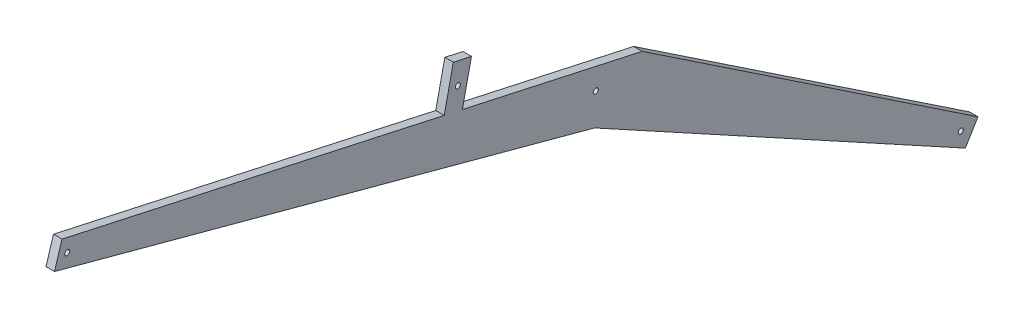
from build123d import *

# Parameters (mm, degrees)
SKETCH_1_R          = 0.6
EXTRUDE_1_DEPTH     = 2
SKETCH_2_W          = 2
SKETCH_2_H          = 4.371689855
EXTRUDE_2_DEPTH     = 10
SKETCH_3_R          = 0.6
CUT_EXTRUDE_1_DEPTH = 139.866853183


with BuildPart() as part:
    # 草图1 → 凸台-拉伸1 (new body)
    with BuildSketch(Plane(origin=(0, 0, 0), x_dir=(0, 0, -1), z_dir=(1, 0, 0))):
        Polygon((-125.665306235, 32.633935399), (10.915414504, 2.625615762), (89.98290861, -50.249012451), (87.007289875, -55.156822928), (-0.286231168, -7.394028573), (-127.427343209, 26.898499434), align=None)
        Circle(SKETCH_1_R, mode=Mode.SUBTRACT)
        with Locations((85.929781066, -51.147558357)):
            Circle(SKETCH_1_R, mode=Mode.SUBTRACT)
        with Locations((-124.4283455, 29.268026496)):
            Circle(SKETCH_1_R, mode=Mode.SUBTRACT)
    extrude(amount=EXTRUDE_1_DEPTH)

    # 草图2 → 凸台-拉伸2 (add)
    with BuildSketch(Plane(origin=(0, 4.792506233, -1.052967491), x_dir=(1, 0, 0), z_dir=(0, 0.9767036122693339, -0.21459276264598237))):
        with Locations((1, -35.420952271)):
            Rectangle(SKETCH_2_W, SKETCH_2_H)
    extrude(amount=EXTRUDE_2_DEPTH)

    # 草图3 → 切除-拉伸1 (cut, through all)
    with BuildSketch(Plane(origin=(2, 0, 0), x_dir=(0, 0, -1), z_dir=(1, 0, 0))):
        with Locations((-32.469840729, 17.277104298)):
            Circle(SKETCH_3_R)
    extrude(amount=-CUT_EXTRUDE_1_DEPTH, mode=Mode.SUBTRACT)


solid = part.part
